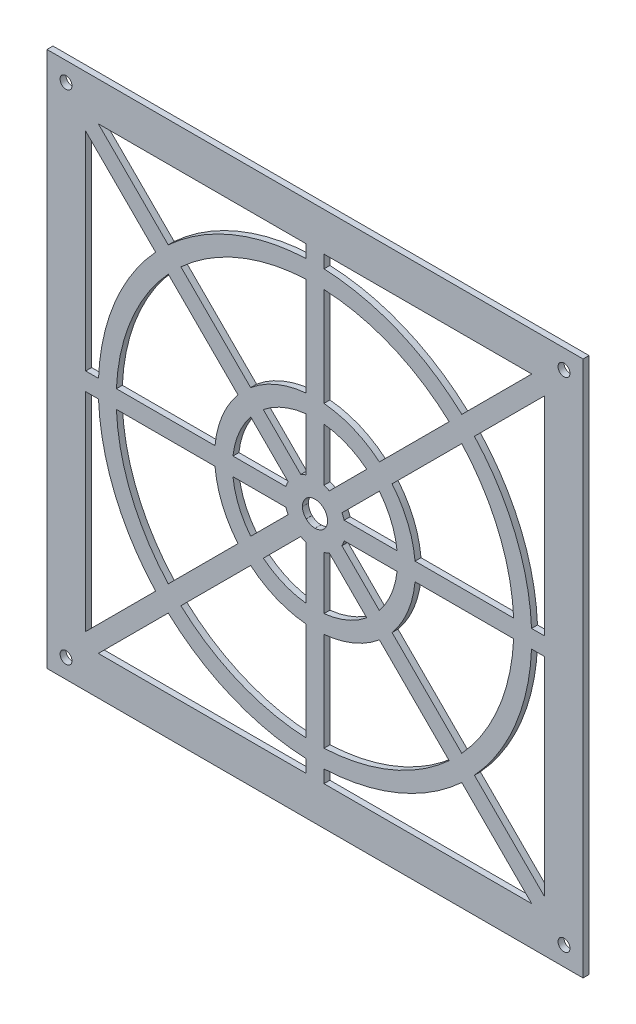
from build123d import *

# Parameters (mm, degrees)
SKETCH1_W           = 228.6
SKETCH1_H           = 228.6
SKETCH1_R           = 2.54
BOSS_EXTRUDE1_DEPTH = 2.54


with BuildPart() as part:
    # Sketch1 → Boss-Extrude1 (new body)
    with BuildSketch(Plane.XY):
        Rectangle(SKETCH1_W, SKETCH1_H)
        with Locations((-106.172, -106.172)):
            Circle(SKETCH1_R, mode=Mode.SUBTRACT)
        with BuildLine():
            Line((-3.81, -97.79), (-92.401846327, -97.79))
            Line((-92.401846327, -97.79), (-62.588329311, -67.976482983))
            ThreePointArc((-62.588329311, -67.976482983), (-35.360655709, -85.368174588), (-3.81, -92.323264158))
            Line((-3.81, -92.323264158), (-3.81, -97.79))
        make_face(mode=Mode.SUBTRACT)
        with BuildLine():
            ThreePointArc((-3.81, -84.696194523), (-32.444607955, -78.32821255), (-57.195176652, -62.583330324))
            Line((-57.195176652, -62.583330324), (-27.460573831, -32.848727503))
            ThreePointArc((-27.460573831, -32.848727503), (-16.384581274, -39.555878326), (-3.81, -42.645115942))
            Line((-3.81, -42.645115942), (-3.81, -84.696194523))
        make_face(mode=Mode.SUBTRACT)
        with BuildLine():
            Line((-67.976482983, -62.588329311), (-97.79, -92.401846327))
            Line((-97.79, -92.401846327), (-97.79, -3.81))
            Line((-97.79, -3.81), (-92.323264158, -3.81))
            ThreePointArc((-92.323264158, -3.81), (-85.368174588, -35.360655709), (-67.976482983, -62.588329311))
        make_face(mode=Mode.SUBTRACT)
        with BuildLine():
            ThreePointArc((-62.583330324, -57.195176652), (-78.32821255, -32.444607955), (-84.696194523, -3.81))
            Line((-84.696194523, -3.81), (-42.645115942, -3.81))
            ThreePointArc((-42.645115942, -3.81), (-39.555878326, -16.384581274), (-32.848727503, -27.460573831))
            Line((-32.848727503, -27.460573831), (-62.583330324, -57.195176652))
        make_face(mode=Mode.SUBTRACT)
        with BuildLine():
            Line((-3.81, -12.415847502), (-3.81, -34.988142381))
            ThreePointArc((-3.81, -34.988142381), (-13.46853352, -32.515916289), (-22.046275902, -27.434429575))
            Line((-22.046275902, -27.434429575), (-6.085253126, -11.473406799))
            ThreePointArc((-6.085253126, -11.473406799), (-4.970015818, -11.998679592), (-3.81, -12.415847502))
        make_face(mode=Mode.SUBTRACT)
        with BuildLine():
            ThreePointArc((-27.434429575, -22.046275902), (-32.515916289, -13.46853352), (-34.988142381, -3.81))
            Line((-34.988142381, -3.81), (-12.415847502, -3.81))
            ThreePointArc((-12.415847502, -3.81), (-11.998679592, -4.970015818), (-11.473406799, -6.085253126))
            Line((-11.473406799, -6.085253126), (-27.434429575, -22.046275902))
        make_face(mode=Mode.SUBTRACT)
        with BuildLine():
            ThreePointArc((3.81, -92.323264158), (35.360655709, -85.368174588), (62.588329311, -67.976482983))
            Line((62.588329311, -67.976482983), (92.401846327, -97.79))
            Line((92.401846327, -97.79), (3.81, -97.79))
            Line((3.81, -97.79), (3.81, -92.323264158))
        make_face(mode=Mode.SUBTRACT)
        with BuildLine():
            ThreePointArc((3.81, -42.645115942), (16.384581274, -39.555878326), (27.460573831, -32.848727503))
            Line((27.460573831, -32.848727503), (57.195176652, -62.583330324))
            ThreePointArc((57.195176652, -62.583330324), (32.444607955, -78.32821255), (3.81, -84.696194523))
            Line((3.81, -84.696194523), (3.81, -42.645115942))
        make_face(mode=Mode.SUBTRACT)
        with Locations((106.172, -106.172)):
            Circle(SKETCH1_R, mode=Mode.SUBTRACT)
        with BuildLine():
            ThreePointArc((3.81, -12.415847502), (4.970015818, -11.998679592), (6.085253126, -11.473406799))
            Line((6.085253126, -11.473406799), (22.046275902, -27.434429575))
            ThreePointArc((22.046275902, -27.434429575), (13.46853352, -32.515916289), (3.81, -34.988142381))
            Line((3.81, -34.988142381), (3.81, -12.415847502))
        make_face(mode=Mode.SUBTRACT)
        with BuildLine():
            Line((27.434429575, -22.046275902), (11.473406799, -6.085253126))
            ThreePointArc((11.473406799, -6.085253126), (11.998679592, -4.970015818), (12.415847502, -3.81))
            Line((12.415847502, -3.81), (34.988142381, -3.81))
            ThreePointArc((34.988142381, -3.81), (32.515916289, -13.46853352), (27.434429575, -22.046275902))
        make_face(mode=Mode.SUBTRACT)
        with BuildLine():
            Line((97.79, -92.401846327), (67.976482983, -62.588329311))
            ThreePointArc((67.976482983, -62.588329311), (85.368174588, -35.360655709), (92.323264158, -3.81))
            Line((92.323264158, -3.81), (97.79, -3.81))
            Line((97.79, -3.81), (97.79, -92.401846327))
        make_face(mode=Mode.SUBTRACT)
        with BuildLine():
            ThreePointArc((32.848727503, -27.460573831), (39.555878326, -16.384581274), (42.645115942, -3.81))
            Line((42.645115942, -3.81), (84.696194523, -3.81))
            ThreePointArc((84.696194523, -3.81), (78.32821255, -32.444607955), (62.583330324, -57.195176652))
            Line((62.583330324, -57.195176652), (32.848727503, -27.460573831))
        make_face(mode=Mode.SUBTRACT)
        with BuildLine():
            Line((-42.645115942, 3.81), (-84.696194523, 3.81))
            ThreePointArc((-84.696194523, 3.81), (-78.32821255, 32.444607955), (-62.583330324, 57.195176652))
            Line((-62.583330324, 57.195176652), (-32.848727503, 27.460573831))
            ThreePointArc((-32.848727503, 27.460573831), (-39.555878326, 16.384581274), (-42.645115942, 3.81))
        make_face(mode=Mode.SUBTRACT)
        with BuildLine():
            Line((-97.79, 3.81), (-97.79, 92.401846327))
            Line((-97.79, 92.401846327), (-67.976482983, 62.588329311))
            ThreePointArc((-67.976482983, 62.588329311), (-85.368174588, 35.360655709), (-92.323264158, 3.81))
            Line((-92.323264158, 3.81), (-97.79, 3.81))
        make_face(mode=Mode.SUBTRACT)
        with BuildLine():
            ThreePointArc((-34.988142381, 3.81), (-32.515916289, 13.46853352), (-27.434429575, 22.046275902))
            Line((-27.434429575, 22.046275902), (-11.473406799, 6.085253126))
            ThreePointArc((-11.473406799, 6.085253126), (-11.998679592, 4.970015818), (-12.415847502, 3.81))
            Line((-12.415847502, 3.81), (-34.988142381, 3.81))
        make_face(mode=Mode.SUBTRACT)
        with BuildLine():
            Line((-3.81, 34.988142381), (-3.81, 12.415847502))
            ThreePointArc((-3.81, 12.415847502), (-4.970015818, 11.998679592), (-6.085253126, 11.473406799))
            Line((-6.085253126, 11.473406799), (-22.046275902, 27.434429575))
            ThreePointArc((-22.046275902, 27.434429575), (-13.46853352, 32.515916289), (-3.81, 34.988142381))
        make_face(mode=Mode.SUBTRACT)
        with Locations((-106.172, 106.172)):
            Circle(SKETCH1_R, mode=Mode.SUBTRACT)
        with BuildLine():
            Line((-27.460573831, 32.848727503), (-57.195176652, 62.583330324))
            ThreePointArc((-57.195176652, 62.583330324), (-32.444607955, 78.32821255), (-3.81, 84.696194523))
            Line((-3.81, 84.696194523), (-3.81, 42.645115942))
            ThreePointArc((-3.81, 42.645115942), (-16.384581274, 39.555878326), (-27.460573831, 32.848727503))
        make_face(mode=Mode.SUBTRACT)
        with BuildLine():
            Line((-62.588329311, 67.976482983), (-92.401846327, 97.79))
            Line((-92.401846327, 97.79), (-3.81, 97.79))
            Line((-3.81, 97.79), (-3.81, 92.323264158))
            ThreePointArc((-3.81, 92.323264158), (-35.360655709, 85.368174588), (-62.588329311, 67.976482983))
        make_face(mode=Mode.SUBTRACT)
        with BuildLine():
            Line((0.020917227, -5.367236445), (0, -5.388153673))
            Line((0, -5.388153673), (-0.020917227, -5.367236445))
            ThreePointArc((-0.020917227, -5.367236445), (-2.053968063, -4.958717554), (-3.780418573, -3.81))
            Line((-3.780418573, -3.81), (-3.81, -3.81))
            Line((-3.81, -3.81), (-3.81, -3.780418573))
            ThreePointArc((-3.81, -3.780418573), (-4.958717554, -2.053968063), (-5.367236445, -0.020917227))
            Line((-5.367236445, -0.020917227), (-5.388153673, 0))
            Line((-5.388153673, 0), (-5.367236445, 0.020917227))
            ThreePointArc((-5.367236445, 0.020917227), (-4.958717554, 2.053968063), (-3.81, 3.780418573))
            Line((-3.81, 3.780418573), (-3.81, 3.81))
            Line((-3.81, 3.81), (-3.780418573, 3.81))
            ThreePointArc((-3.780418573, 3.81), (-2.053968063, 4.958717554), (-0.020917227, 5.367236445))
            Line((-0.020917227, 5.367236445), (0, 5.388153673))
            Line((0, 5.388153673), (0.020917227, 5.367236445))
            ThreePointArc((0.020917227, 5.367236445), (2.053968063, 4.958717554), (3.780418573, 3.81))
            Line((3.780418573, 3.81), (3.81, 3.81))
            Line((3.81, 3.81), (3.81, 3.780418573))
            ThreePointArc((3.81, 3.780418573), (4.958717554, 2.053968063), (5.367236445, 0.020917227))
            Line((5.367236445, 0.020917227), (5.388153673, 0))
            Line((5.388153673, 0), (5.367236445, -0.020917227))
            ThreePointArc((5.367236445, -0.020917227), (4.958717554, -2.053968063), (3.81, -3.780418573))
            Line((3.81, -3.780418573), (3.81, -3.81))
            Line((3.81, -3.81), (3.780418573, -3.81))
            ThreePointArc((3.780418573, -3.81), (2.053968063, -4.958717554), (0.020917227, -5.367236445))
        make_face(mode=Mode.SUBTRACT)
        with BuildLine():
            Line((34.988142381, 3.81), (12.415847502, 3.81))
            ThreePointArc((12.415847502, 3.81), (11.998679592, 4.970015818), (11.473406799, 6.085253126))
            Line((11.473406799, 6.085253126), (27.434429575, 22.046275902))
            ThreePointArc((27.434429575, 22.046275902), (32.515916289, 13.46853352), (34.988142381, 3.81))
        make_face(mode=Mode.SUBTRACT)
        with BuildLine():
            Line((22.046275902, 27.434429575), (6.085253126, 11.473406799))
            ThreePointArc((6.085253126, 11.473406799), (4.970015818, 11.998679592), (3.81, 12.415847502))
            Line((3.81, 12.415847502), (3.81, 34.988142381))
            ThreePointArc((3.81, 34.988142381), (13.46853352, 32.515916289), (22.046275902, 27.434429575))
        make_face(mode=Mode.SUBTRACT)
        with BuildLine():
            ThreePointArc((42.645115942, 3.81), (39.555878326, 16.384581274), (32.848727503, 27.460573831))
            Line((32.848727503, 27.460573831), (62.583330324, 57.195176652))
            ThreePointArc((62.583330324, 57.195176652), (78.32821255, 32.444607955), (84.696194523, 3.81))
            Line((84.696194523, 3.81), (42.645115942, 3.81))
        make_face(mode=Mode.SUBTRACT)
        with BuildLine():
            Line((97.79, 92.401846327), (97.79, 3.81))
            Line((97.79, 3.81), (92.323264158, 3.81))
            ThreePointArc((92.323264158, 3.81), (85.368174588, 35.360655709), (67.976482983, 62.588329311))
            Line((67.976482983, 62.588329311), (97.79, 92.401846327))
        make_face(mode=Mode.SUBTRACT)
        with BuildLine():
            Line((57.195176652, 62.583330324), (27.460573831, 32.848727503))
            ThreePointArc((27.460573831, 32.848727503), (16.384581274, 39.555878326), (3.81, 42.645115942))
            Line((3.81, 42.645115942), (3.81, 84.696194523))
            ThreePointArc((3.81, 84.696194523), (32.444607955, 78.32821255), (57.195176652, 62.583330324))
        make_face(mode=Mode.SUBTRACT)
        with BuildLine():
            ThreePointArc((62.588329311, 67.976482983), (35.360655709, 85.368174588), (3.81, 92.323264158))
            Line((3.81, 92.323264158), (3.81, 97.79))
            Line((3.81, 97.79), (92.401846327, 97.79))
            Line((92.401846327, 97.79), (62.588329311, 67.976482983))
        make_face(mode=Mode.SUBTRACT)
        with Locations((106.172, 106.172)):
            Circle(SKETCH1_R, mode=Mode.SUBTRACT)
    extrude(amount=BOSS_EXTRUDE1_DEPTH)


solid = part.part
